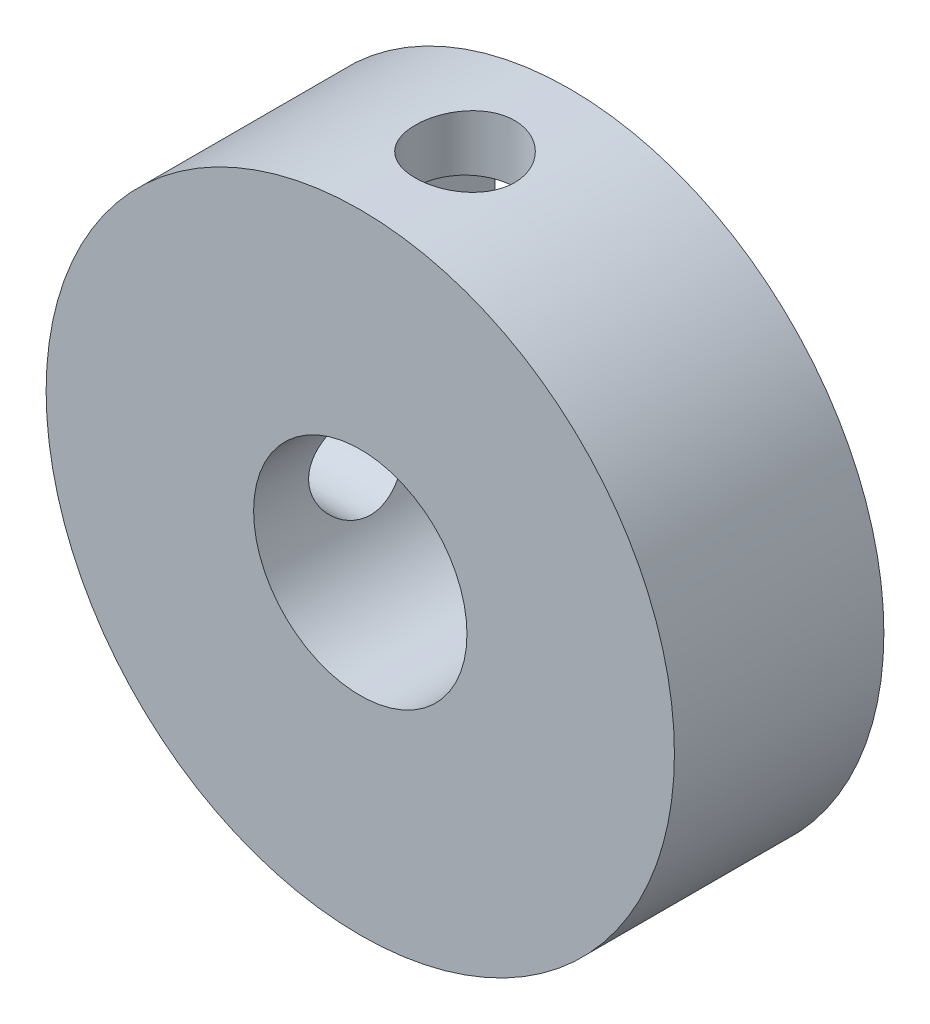
from build123d import *
from build123d.topology import SkipClean

# Parameters (mm, degrees)
SKETCH2_R           = 12
SKETCH2_R_2         = 4.075
BOSS_EXTRUDE2_DEPTH = 8
SKETCH5_R           = 1.9
CUT_EXTRUDE8_DEPTH  = 19.761663039
CUT_EXTRUDE7_DEPTH  = 2.8
CIRPATTERN1_COUNT   = 2
CIRPATTERN1_ANGLE   = 90
BOSS_EXTRUDE3_START = 2.5
SKETCH17_R          = 5.575
SKETCH17_R_2        = 4.075
BOSS_EXTRUDE3_DEPTH = 2.5


with BuildPart() as part:
    # Sketch2 → Boss-Extrude2 (new body)
    with BuildSketch(Plane.XY):
        Circle(SKETCH2_R)
        Circle(SKETCH2_R_2, mode=Mode.SUBTRACT)
    extrude(amount=BOSS_EXTRUDE2_DEPTH)

    # Sketch5 → Cut-Extrude8 (cut, through all)
    with BuildSketch(Plane(origin=(0, 0, 0), x_dir=(0, 0, -1), z_dir=(0, -1, 0))):
        with Locations((-4, 0)):
            Circle(SKETCH5_R)
    cut_extrude8 = extrude(amount=-CUT_EXTRUDE8_DEPTH, mode=Mode.SUBTRACT)

    # Sketch16 → Cut-Extrude7 (cut)
    with BuildSketch(Plane(origin=(0, 7, 0), x_dir=(1, 0, 0), z_dir=(0, 1, 0))):
        Polygon((0, -7.290896534), (2.85, -5.645448267), (2.85, -2.354551733), (2.85, 0), (-2.85, 0), (-2.85, -2.354551733), (-2.85, -5.645448267), align=None)
    cut_extrude7 = extrude(amount=CUT_EXTRUDE7_DEPTH, mode=Mode.SUBTRACT)

    # CirPattern1: Cut-Extrude8, Cut-Extrude7 ×2 about axis
    cirpattern1_axis = Axis((0, 0, 0), (0, 0, 1))
    add([cut_extrude8.rotate(cirpattern1_axis, i * CIRPATTERN1_ANGLE / (CIRPATTERN1_COUNT - 1)) for i in range(1, CIRPATTERN1_COUNT)], mode=Mode.SUBTRACT)
    add([cut_extrude7.rotate(cirpattern1_axis, i * CIRPATTERN1_ANGLE / (CIRPATTERN1_COUNT - 1)) for i in range(1, CIRPATTERN1_COUNT)], mode=Mode.SUBTRACT)

    # Sketch17 → Boss-Extrude3 (add)
    with SkipClean():  # the faces are left unmerged after this step: merging them gives an invalid solid
        with BuildSketch(Plane(origin=(0, 0, 0), x_dir=(-1, 0, 0), z_dir=(0, 0, -1)).offset(BOSS_EXTRUDE3_START)):
            with Locations(Location((0, 0, 0), (0, 0, 180))):
                Circle(SKETCH17_R)
            Circle(SKETCH17_R_2, mode=Mode.SUBTRACT)
        extrude(amount=-BOSS_EXTRUDE3_DEPTH)


solid = part.part
